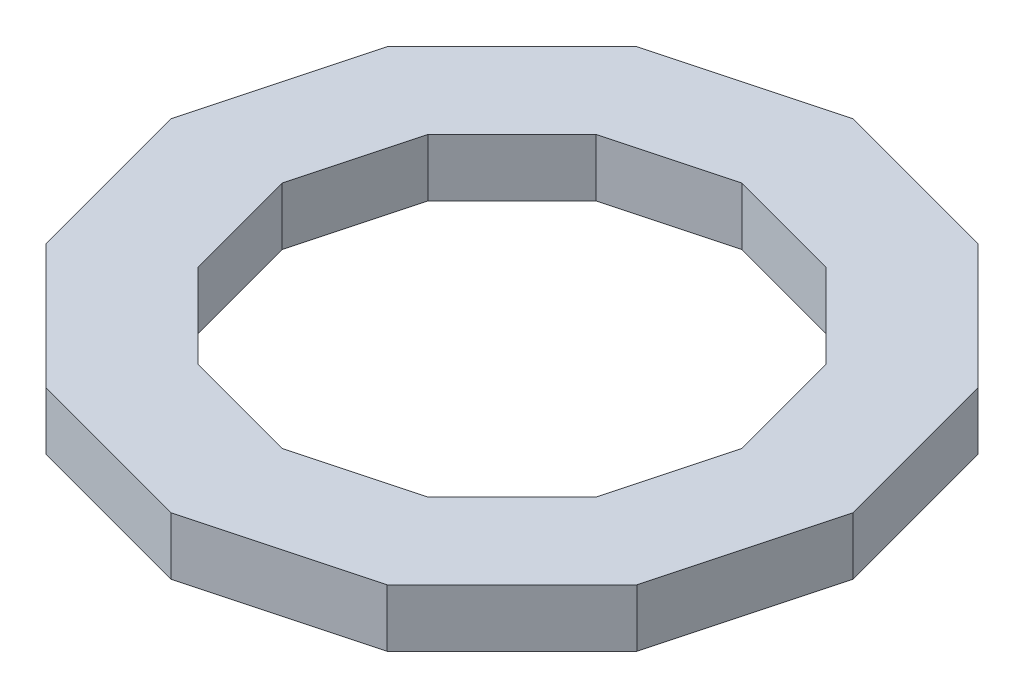
from build123d import *

# Parameters (mm, degrees)
BOSS_EXTRUDE1_DEPTH = 19.05


with BuildPart() as part:
    # Sketch1 → Boss-Extrude1 (new body)
    with BuildSketch(Plane(origin=(0, 0, 0), x_dir=(1, 0, 0), z_dir=(0, 1, 0))):
        Polygon((112.858773544, 0), (97.738564929, 56.429386772), (56.429386772, 97.738564929), (0, 112.858773544), (-56.429386772, 97.738564929), (-97.738564929, 56.429386772), (-112.858773544, 0), (-97.738564929, -56.429386772), (-56.429386772, -97.738564929), (0, -112.858773544), (56.429386772, -97.738564929), (97.738564929, -56.429386772), align=None)
        Polygon((76.044352568, 0), (65.856341138, 38.022176284), (38.022176284, 65.856341138), (0, 76.044352568), (-38.022176284, 65.856341138), (-65.856341138, 38.022176284), (-76.044352568, 0), (-65.856341138, -38.022176284), (-38.022176284, -65.856341138), (0, -76.044352568), (38.022176284, -65.856341138), (65.856341138, -38.022176284), align=None, mode=Mode.SUBTRACT)
    extrude(amount=BOSS_EXTRUDE1_DEPTH)


solid = part.part
